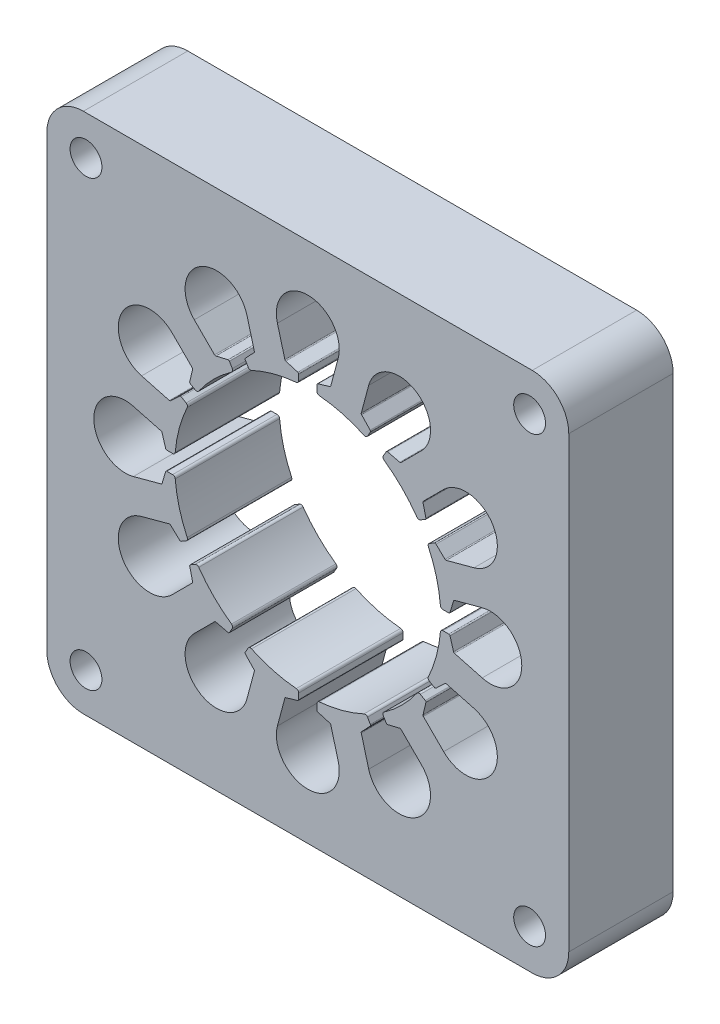
from build123d import *

# Parameters (mm, degrees)
SKETCH1_W           = 100
SKETCH1_H           = 100
BOSS_EXTRUDE1_DEPTH = 20
SKETCH2_R           = 25.5
CUT_EXTRUDE1_DEPTH  = 143.828568571
CUT_EXTRUDE2_DEPTH  = 143.828568571
CIRPATTERN7_COUNT   = 12
FILLET4_R           = 0.2525
FILLET5_R           = 0.505
SKETCH4_R           = 3.05
CUT_EXTRUDE3_DEPTH  = 143.828568571
FILLET7_R           = 7


with BuildPart() as part:
    # Sketch1 → Boss-Extrude1 (new body)
    with BuildSketch(Plane.XY):
        with Locations((50, 50)):
            Rectangle(SKETCH1_W, SKETCH1_H)
    extrude(amount=BOSS_EXTRUDE1_DEPTH)

    # Sketch2 → Cut-Extrude1 (cut, through all)
    with BuildSketch(Plane.XY.offset(20)):
        with Locations((50, 50)):
            Circle(SKETCH2_R)
    extrude(amount=-CUT_EXTRUDE1_DEPTH, mode=Mode.SUBTRACT)

    # Sketch3 → Cut-Extrude2 (cut, symmetric)
    with BuildSketch(Plane.XY.offset(20)):
        with BuildLine():
            Line((48.25, 77.18988011), (48.25, 75.43988011))
            ThreePointArc((48.25, 75.43988011), (50, 75.5), (51.75, 75.43988011))
            Line((51.75, 75.43988011), (51.75, 77.18988011))
            Line((51.75, 77.18988011), (54.361456596, 77.96488011))
            Line((54.361456596, 77.96488011), (55.821388232, 83.413419151))
            ThreePointArc((55.821388232, 83.413419151), (50, 91), (44.178611768, 83.413419151))
            Line((44.178611768, 83.413419151), (45.638543404, 77.96488011))
            Line((45.638543404, 77.96488011), (48.25, 77.18988011))
        make_face()
    cut_extrude2 = extrude(amount=CUT_EXTRUDE2_DEPTH, both=True, mode=Mode.SUBTRACT)

    # CirPattern7: Cut-Extrude2 ×12 about axis
    cirpattern7_axis = Axis((50, 50, 20), (0, 0, 1))
    for i in range(1, CIRPATTERN7_COUNT):
        add(cut_extrude2.rotate(cirpattern7_axis, i * 360 / CIRPATTERN7_COUNT), mode=Mode.SUBTRACT)

    # Fillet4
    fillet4_edges = [part.edges().sort_by_distance(p)[0] for p in [
        (22.81011989, 48.25, 10),
        (22.03511989, 45.638543404, 10),
        (22.03511989, 54.361456596, 10),
        (22.81011989, 51.75, 10),
        (27.327873099, 34.889515488, 10),
        (27.962431709, 32.240427735, 10),
        (23.600975113, 39.794692155, 10),
        (25.577873099, 37.920604402, 10),
        (37.920604402, 25.577873099, 10),
        (39.794692155, 23.600975113, 10),
        (32.240427735, 27.962431709, 10),
        (34.889515488, 27.327873099, 10),
        (51.75, 22.81011989, 10),
        (54.361456596, 22.03511989, 10),
        (45.638543404, 22.03511989, 10),
        (48.25, 22.81011989, 10),
        (65.110484512, 27.327873099, 10),
        (67.759572265, 27.962431709, 10),
        (60.205307845, 23.600975113, 10),
        (62.079395598, 25.577873099, 10),
        (48.25, 77.18988011, 10),
        (45.638543404, 77.96488011, 10),
        (54.361456596, 77.96488011, 10),
        (74.422126901, 37.920604402, 10),
        (76.399024887, 39.794692155, 10),
        (72.037568291, 32.240427735, 10),
        (72.672126901, 34.889515488, 10),
        (51.75, 77.18988011, 10),
        (77.18988011, 51.75, 10),
        (77.96488011, 54.361456596, 10),
        (77.96488011, 45.638543404, 10),
        (77.18988011, 48.25, 10),
        (72.672126901, 65.110484512, 10),
        (72.037568291, 67.759572265, 10),
        (76.399024887, 60.205307845, 10),
        (74.422126901, 62.079395598, 10),
        (62.079395598, 74.422126901, 10),
        (60.205307845, 76.399024887, 10),
        (67.759572265, 72.037568291, 10),
        (65.110484512, 72.672126901, 10),
        (34.889515488, 72.672126901, 10),
        (32.240427735, 72.037568291, 10),
        (39.794692155, 76.399024887, 10),
        (37.920604402, 74.422126901, 10),
        (25.577873099, 62.079395598, 10),
        (23.600975113, 60.205307845, 10),
        (27.962431709, 67.759572265, 10),
        (27.327873099, 65.110484512, 10),
    ]]
    fillet(fillet4_edges, radius=FILLET4_R)

    # Fillet5
    fillet5_edges = [part.edges().sort_by_distance(p)[0] for p in [
        (24.56011989, 51.75, 10),
        (24.56011989, 48.25, 10),
        (27.093417556, 38.795604402, 10),
        (28.843417556, 35.764515488, 10),
        (35.764515488, 28.843417556, 10),
        (38.795604402, 27.093417556, 10),
        (51.75, 75.43988011, 10),
        (48.25, 75.43988011, 10),
        (48.25, 24.56011989, 10),
        (51.75, 24.56011989, 10),
        (61.204395598, 27.093417556, 10),
        (64.235484512, 28.843417556, 10),
        (71.156582444, 35.764515488, 10),
        (72.906582444, 38.795604402, 10),
        (75.43988011, 48.25, 10),
        (75.43988011, 51.75, 10),
        (72.906582444, 61.204395598, 10),
        (71.156582444, 64.235484512, 10),
        (64.235484512, 71.156582444, 10),
        (61.204395598, 72.906582444, 10),
        (38.795604402, 72.906582444, 10),
        (35.764515488, 71.156582444, 10),
        (28.843417556, 64.235484512, 10),
        (27.093417556, 61.204395598, 10),
    ]]
    fillet(fillet5_edges, radius=FILLET5_R)

    # Sketch4 → Cut-Extrude3 (cut, through all)
    with BuildSketch(Plane.XY.offset(20)):
        with Locations((92.5, 92.5)):
            Circle(SKETCH4_R)
        with Locations((92.5, 7.5)):
            Circle(SKETCH4_R)
        with Locations((7.5, 7.5)):
            Circle(SKETCH4_R)
        with Locations((7.5, 92.5)):
            Circle(SKETCH4_R)
    extrude(amount=-CUT_EXTRUDE3_DEPTH, mode=Mode.SUBTRACT)

    # Fillet7
    fillet7_edges = [part.edges().sort_by_distance(p)[0] for p in [
        (0, 100, 10),
        (100, 100, 10),
        (100, 0, 10),
        (0, 0, 10),
    ]]
    fillet(fillet7_edges, radius=FILLET7_R)


solid = part.part
